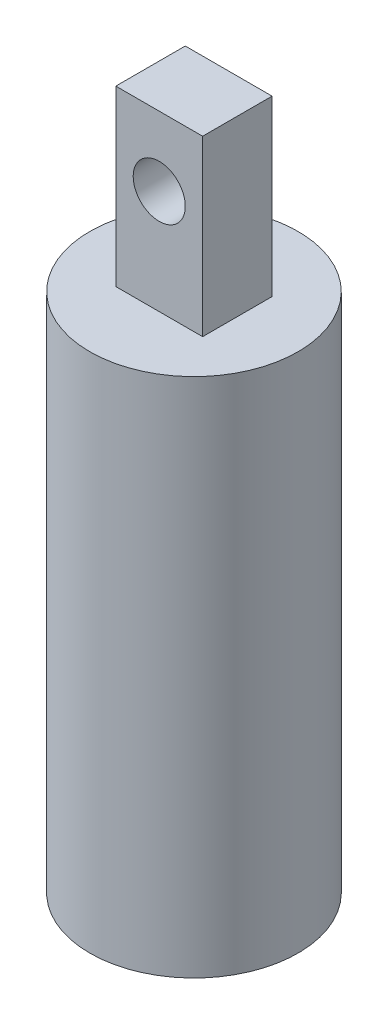
from build123d import *

# Parameters (mm, degrees)
SKETCH2_R           = 30
BOSS_EXTRUDE1_DEPTH = 150
SKETCH3_R           = 20
CUT_EXTRUDE1_DEPTH  = 100
SKETCH4_W           = 25
SKETCH4_H           = 20
BOSS_EXTRUDE2_DEPTH = 50
SKETCH5_R           = 7.5
CUT_EXTRUDE2_DEPTH  = 40


with BuildPart() as part:
    # Sketch2 → Boss-Extrude1 (new body)
    with BuildSketch(Plane(origin=(0, 0, 0), x_dir=(1, 0, 0), z_dir=(0, 1, 0))):
        with Locations(Location((0, 0, 0), (0, 0, 270))):
            Circle(SKETCH2_R)
    extrude(amount=BOSS_EXTRUDE1_DEPTH)

    # Sketch3 → Cut-Extrude1 (cut)
    with BuildSketch(Plane(origin=(0, 0, 0), x_dir=(0, 0, -1), z_dir=(1, 0, 0))):
        with Locations((0, 50)):
            Circle(SKETCH3_R)
    extrude(amount=-CUT_EXTRUDE1_DEPTH, mode=Mode.SUBTRACT)

    # Sketch4 → Boss-Extrude2 (add)
    with BuildSketch(Plane(origin=(0, 150, 0), x_dir=(1, 0, 0), z_dir=(0, 1, 0))):
        Rectangle(SKETCH4_W, SKETCH4_H)
    extrude(amount=BOSS_EXTRUDE2_DEPTH)

    # Sketch5 → Cut-Extrude2 (cut)
    with BuildSketch(Plane(origin=(0, 0, -10), x_dir=(-1, 0, 0), z_dir=(0, 0, -1))):
        with Locations((0, 180)):
            Circle(SKETCH5_R)
    extrude(amount=-CUT_EXTRUDE2_DEPTH, mode=Mode.SUBTRACT)


solid = part.part
